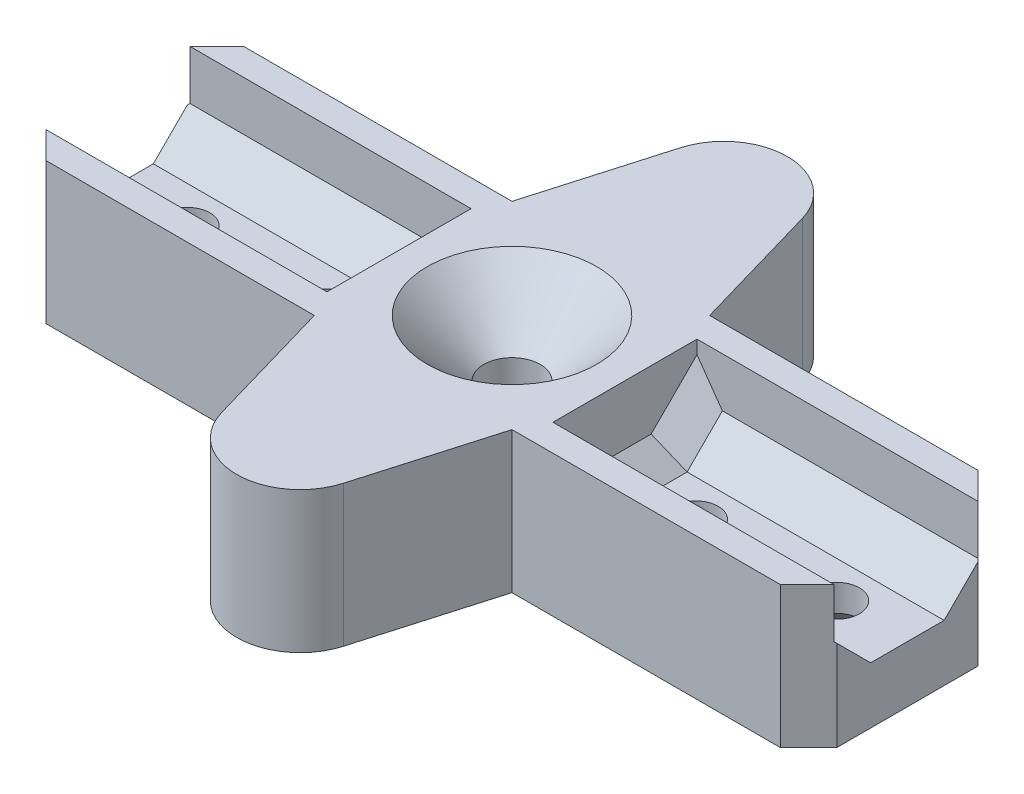
from build123d import *

# Parameters (mm, degrees)
ESQUISSE1_R                  = 2
BOSS_EXTRU_1_DEPTH           = 10
ESQUISSE2_W                  = 10.2
ESQUISSE2_H                  = 6
ENL_V_MAT_EXTRU_1_DEPTH      = 20
CHANFREIN1_SIZE              = 2.5
CHANFREIN2_SIZE              = 1.8
CHANFREIN1_OF_SYM_TRIE1_SIZE = 2.5
CHANFREIN2_OF_SYM_TRIE1_SIZE = 1.8
ESQUISSE5_R                  = 1.6
ENL_V_MAT_EXTRU_4_DEPTH      = 7
CHANFREIN4_SIZE              = 2.1
CHANFREIN5_SIZE              = 2
ENL_V_MAT_EXTRU_5_DEPTH      = 4
CHANFREIN6_SIZE              = 4


with BuildPart() as part:
    # Esquisse1 → Boss.-Extru.1 (new body)
    with BuildSketch(Plane(origin=(0, 0, 0), x_dir=(1, 0, 0), z_dir=(0, 1, 0))):
        with BuildLine():
            Line((7, 7), (28, 7))
            Line((28, 7), (28, -7))
            Line((28, -7), (7, -7))
            Line((7, -7), (4.322606063, -16.251030305))
            ThreePointArc((4.322606063, -16.251030305), (0, -19.5), (-4.322606063, -16.251030305))
            Line((-4.322606063, -16.251030305), (-7, -7))
            Line((-7, -7), (-28, -7))
            Line((-28, -7), (-28, 7))
            Line((-28, 7), (-7, 7))
            Line((-7, 7), (-4.322606063, 16.251030305))
            ThreePointArc((-4.322606063, 16.251030305), (0, 19.5), (4.322606063, 16.251030305))
            Line((4.322606063, 16.251030305), (7, 7))
        make_face()
        with Locations(Location((0, 0, 0), (0, 0, 270))):
            Circle(ESQUISSE1_R, mode=Mode.SUBTRACT)
    extrude(amount=BOSS_EXTRU_1_DEPTH)

    # Esquisse2 → Enlèv. mat.-Extru.1 (cut)
    with BuildSketch(Plane.ZY.offset(28)):
        with Locations((0, 7)):
            Rectangle(ESQUISSE2_W, ESQUISSE2_H)
    enl_v_mat_extru_1 = extrude(amount=-ENL_V_MAT_EXTRU_1_DEPTH, mode=Mode.SUBTRACT)

    # Chanfrein1
    chanfrein1_edges = [part.edges().sort_by_distance(p)[0] for p in [
        (-18, 4, -5.1),
        (-18, 4, 5.1),
    ]]
    chamfer(chanfrein1_edges, length=CHANFREIN1_SIZE)

    # Chanfrein2
    chanfrein2_edges = [part.edges().sort_by_distance(p)[0] for p in [
        (-8, 4, 0),
        (-8, 5.25, -3.85),
        (-8, 5.25, 3.85),
    ]]
    chamfer(chanfrein2_edges, length=CHANFREIN2_SIZE)

    # Symétrie1: Enlèv. mat.-Extru.1 across plane
    add(enl_v_mat_extru_1.mirror(Plane(origin=(0, 0, 0), x_dir=(0, 0, 1), z_dir=(1, 0, 0))), mode=Mode.SUBTRACT)

    # Chanfrein1 of Symétrie1
    chanfrein1_of_sym_trie1_edges = [part.edges().sort_by_distance(p)[0] for p in [
        (18, 4, -5.1),
        (18, 4, 5.1),
    ]]
    chamfer(chanfrein1_of_sym_trie1_edges, length=CHANFREIN1_OF_SYM_TRIE1_SIZE)

    # Chanfrein2 of Symétrie1
    chanfrein2_of_sym_trie1_edges = [part.edges().sort_by_distance(p)[0] for p in [
        (8, 4, 0),
        (8, 5.25, -3.85),
        (8, 5.25, 3.85),
    ]]
    chamfer(chanfrein2_of_sym_trie1_edges, length=CHANFREIN2_OF_SYM_TRIE1_SIZE)

    # Esquisse5 → Enlèv. mat.-Extru.4 (cut)
    with BuildSketch(Plane.XZ):
        with Locations(Location((-23, 0, 0), (0, 0, 270))):
            Circle(ESQUISSE5_R)
        with Locations(Location((-13, 0, 0), (0, 0, 270))):
            Circle(ESQUISSE5_R)
        with Locations(Location((13, 0, 0), (0, 0, 270))):
            Circle(ESQUISSE5_R)
        with Locations(Location((23, 0, 0), (0, 0, 270))):
            Circle(ESQUISSE5_R)
    extrude(amount=-ENL_V_MAT_EXTRU_4_DEPTH, mode=Mode.SUBTRACT)

    # Chanfrein4
    chanfrein4_edges = [part.edges().sort_by_distance(p)[0] for p in [
        (-23, 0, 1.6),
        (-13, 0, 1.6),
        (13, 0, 1.6),
        (23, 0, 1.6),
    ]]
    chamfer(chanfrein4_edges, length=CHANFREIN4_SIZE)

    # Chanfrein5
    chanfrein5_edges = [part.edges().sort_by_distance(p)[0] for p in [
        (28, 5, -7),
        (28, 5, 7),
        (-28, 5, -7),
        (-28, 5, 7),
    ]]
    chamfer(chanfrein5_edges, length=CHANFREIN5_SIZE)

    # Esquisse6 → Enlèv. mat.-Extru.5 (cut)
    with BuildSketch(Plane.XZ):
        with BuildLine():
            Line((-3.979949748, -0.4), (-2.487468593, -15.25))
            ThreePointArc((-2.487468593, -15.25), (0, -17.5), (2.487468593, -15.25))
            Line((2.487468593, -15.25), (3.979949748, -0.4))
            ThreePointArc((3.979949748, -0.4), (4, 0), (3.979949748, 0.4))
            Line((3.979949748, 0.4), (2.487468593, 15.25))
            ThreePointArc((2.487468593, 15.25), (0, 17.5), (-2.487468593, 15.25))
            Line((-2.487468593, 15.25), (-3.979949748, 0.4))
            ThreePointArc((-3.979949748, 0.4), (-4, 0), (-3.979949748, -0.4))
        make_face()
    extrude(amount=-ENL_V_MAT_EXTRU_5_DEPTH, mode=Mode.SUBTRACT)

    # Chanfrein6
    chanfrein6_edges = [part.edges().sort_by_distance(p)[0] for p in [
        (0, 10, -2),
    ]]
    chamfer(chanfrein6_edges, length=CHANFREIN6_SIZE)


solid = part.part
